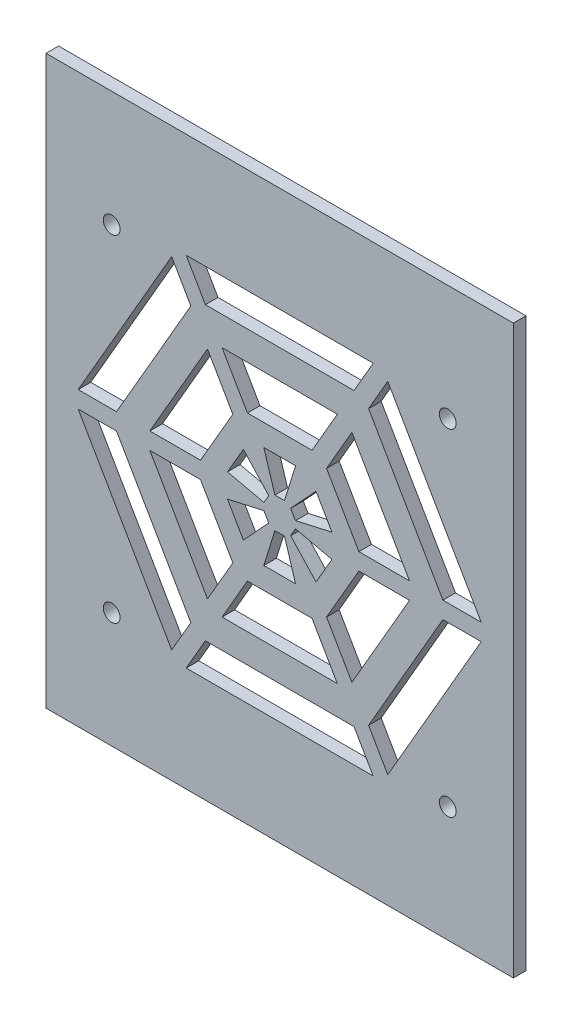
from build123d import *

# Parameters (mm, degrees)
SKETCH1_W           = 111.25
SKETCH1_H           = 135
BOSS_EXTRUDE1_DEPTH = 3
SKETCH2_R           = 2
CUT_EXTRUDE2_DEPTH  = 10


with BuildPart() as part:
    # Sketch1 → Boss-Extrude1 (new body)
    with BuildSketch(Plane.XY):
        with Locations((-55.625, 8.729765013)):
            Rectangle(SKETCH1_W, SKETCH1_H)
    extrude(amount=BOSS_EXTRUDE1_DEPTH)

    # Sketch2 → Cut-Extrude2 (cut)
    with BuildSketch(Plane.XY.offset(3)):
        Polygon((-81.342935317, 49.274535649), (-103.59676902, 10.729765013), (-94.470299462, 10.729765013), (-76.779700538, 41.370781164), align=None)
        Polygon((-37.934401077, 43.370781164), (-73.315598923, 43.370781164), (-77.878833702, 51.274535649), (-33.371166298, 51.274535649), align=None)
        Polygon((-16.779700538, 10.729765013), (-34.470299462, 41.370781164), (-29.907064683, 49.274535649), (-7.65323098, 10.729765013), align=None)
        Polygon((-29.907064683, -31.815005622), (-7.65323098, 6.729765013), (-16.779700538, 6.729765013), (-34.470299462, -23.911251138), align=None)
        Polygon((-77.878833702, -33.815005622), (-73.315598923, -25.911251138), (-37.934401077, -25.911251138), (-33.371166298, -33.815005622), align=None)
        Polygon((-103.59676902, 6.729765013), (-81.342935317, -31.815005622), (-76.779700538, -23.911251138), (-94.470299462, 6.729765013), align=None)
        Polygon((-66.779700538, 24.050273089), (-74.470299462, 10.729765013), (-86.531050208, 10.729765013), (-72.810075912, 34.495189624), align=None)
        Polygon((-74.470299462, 6.729765013), (-66.779700538, -6.590743063), (-72.810075912, -17.035659598), (-86.531050208, 6.729765013), align=None)
        Polygon((-47.934401077, -8.590743063), (-41.904025704, -19.035659598), (-69.345974296, -19.035659598), (-63.315598923, -8.590743063), align=None)
        Polygon((-38.439924088, -17.035659598), (-44.470299462, -6.590743063), (-36.779700538, 6.729765013), (-24.718949792, 6.729765013), align=None)
        Polygon((-36.779700538, 10.729765013), (-44.470299462, 24.050273089), (-38.439924088, 34.495189624), (-24.718949792, 10.729765013), align=None)
        Polygon((-47.934401077, 26.050273089), (-63.315598923, 26.050273089), (-69.345974296, 36.495189624), (-41.904025704, 36.495189624), align=None)
        Polygon((-54.482668179, 12.406598332), (-51.84377359, 20.900431181), (-59.40622641, 20.900431181), (-56.767331821, 12.406598332), align=None)
        Polygon((-58.238065149, 11.557470049), (-64.274492877, 18.089736226), (-68.055719287, 11.540459968), (-59.38039697, 9.578893296), align=None)
        Polygon((-59.38039697, 7.88063673), (-68.055719287, 5.919070058), (-64.274492877, -0.630206199), (-58.238065149, 5.902059977), align=None)
        Polygon((-56.767331821, 5.052931694), (-59.40622641, -3.440901155), (-51.84377359, -3.440901155), (-54.482668179, 5.052931694), align=None)
        Polygon((-53.011934851, 5.902059977), (-46.975507123, -0.630206199), (-43.194280713, 5.919070058), (-51.86960303, 7.88063673), align=None)
        Polygon((-51.86960303, 9.578893296), (-43.194280713, 11.540459968), (-46.975507123, 18.089736226), (-53.011934851, 11.557470049), align=None)
        with Locations((-15.625, -31.270234987)):
            Circle(SKETCH2_R)
        with Locations((-95.625, -31.270234987)):
            Circle(SKETCH2_R)
        with Locations((-95.625, 48.729765013)):
            Circle(SKETCH2_R)
        with Locations((-15.625, 48.729765013)):
            Circle(SKETCH2_R)
    extrude(amount=-CUT_EXTRUDE2_DEPTH, mode=Mode.SUBTRACT)


solid = part.part
